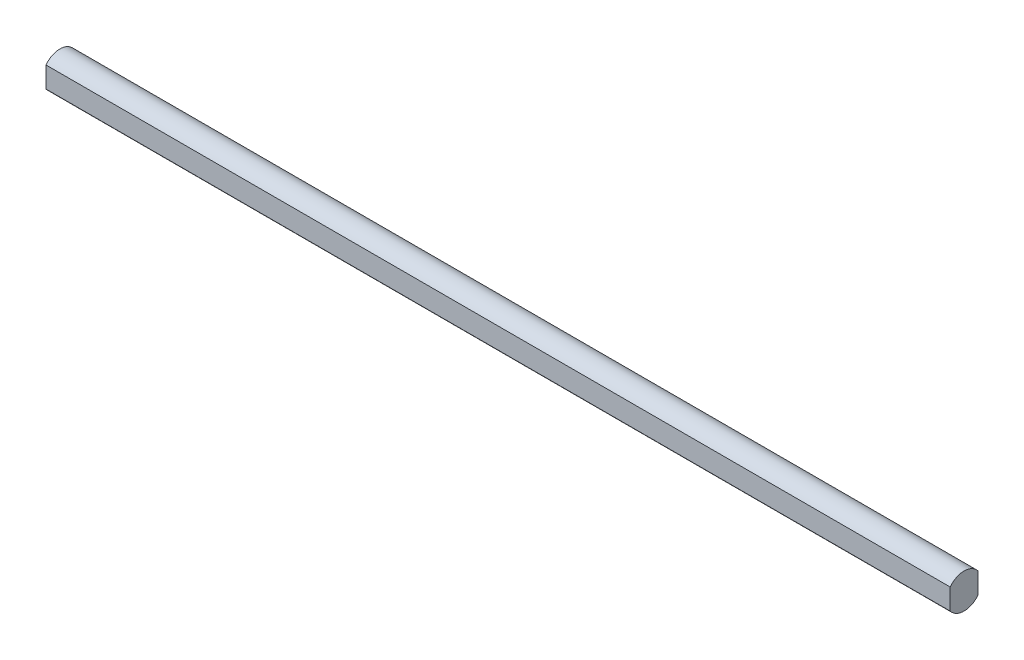
from build123d import *

# Parameters (mm, degrees)
ESBO_O1_R                = 2.5
RESSALTO_EXTRUS_O1_DEPTH = 65
ESBO_O2_W                = 7.122508342
ESBO_O2_H                = 3.466033472
CORTE_EXTRUS_O1_DEPTH    = 130


with BuildPart() as part:
    # Esboço1 → Ressalto-extrusão1 (new, symmetric)
    with BuildSketch(Plane.YZ):
        with Locations(Location((0, 0, 0), (0, 0, 270))):
            Circle(ESBO_O1_R)
    extrude(amount=RESSALTO_EXTRUS_O1_DEPTH, both=True)

    # Esboço2 → Corte-extrusão1 (cut)
    with BuildSketch(Plane.YZ.offset(65)):
        with Locations((0.399926939, 3.733016736)):
            Rectangle(ESBO_O2_W, ESBO_O2_H)
    corte_extrus_o1 = extrude(amount=-CORTE_EXTRUS_O1_DEPTH, mode=Mode.SUBTRACT)

    # Espelhar1: Corte-extrusão1 across plane
    add(corte_extrus_o1.mirror(Plane.XY), mode=Mode.SUBTRACT)


solid = part.part
